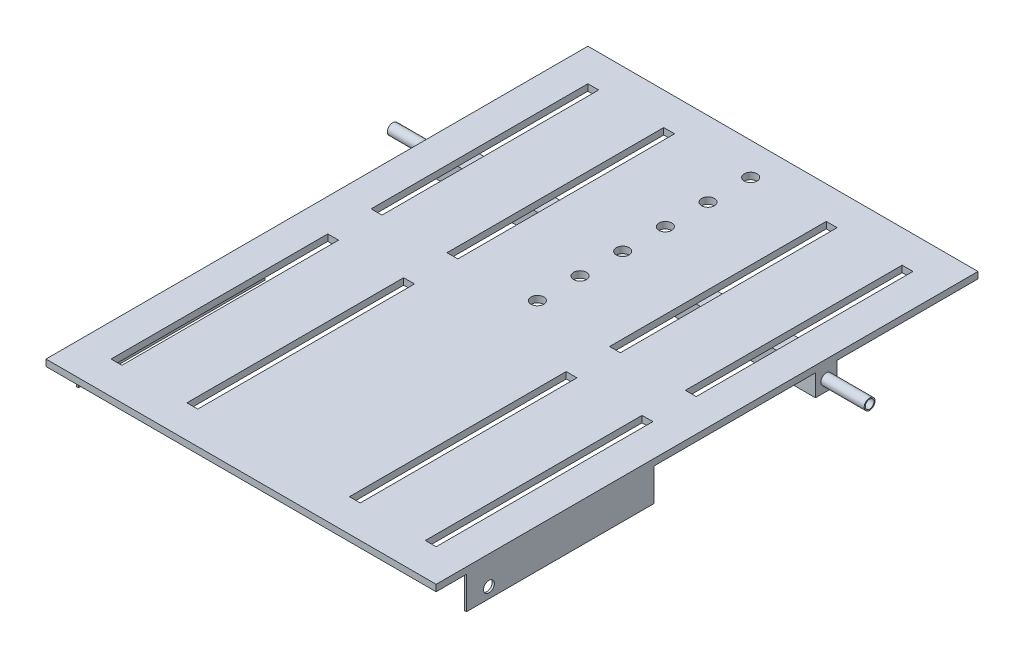
from build123d import *

# Parameters (mm, degrees)
SKETCH1_W               = 457.2
SKETCH1_H               = 635
BOSS_EXTRUDE1_DEPTH     = 7.62
SKETCH2_W               = 12.7
SKETCH2_H               = 254
CUT_EXTRUDE1_DEPTH      = 392.308413403
SKETCH5_W               = 25.4
SKETCH5_H               = 25.4
BOSS_EXTRUDE3_DEPTH     = 228.6
SKETCH6_R               = 6.35
BOSS_EXTRUDE4_DEPTH     = 50.8
BOSS_EXTRUDE6_DEPTH     = 38.1
CUT_EXTRUDE2_DEPTH      = 426.395026299
CUT_EXTRUDE2_DEPTH_BACK = 38.1
SKETCH8_W               = 152.4
SKETCH8_H               = 38.1
BOSS_EXTRUDE7_DEPTH     = 2.54
SKETCH9_W               = 457.2
SKETCH9_H               = 38.1
CUT_EXTRUDE3_DEPTH      = 10.16
CUT_EXTRUDE4_DEPTH      = 601.268156743
CUT_EXTRUDE4_DEPTH_BACK = 601.268156743
SKETCH10_R              = 6.35
SKETCH11_R              = 5.08
CUT_EXTRUDE5_DEPTH      = 25.4
SKETCH12_W              = 67.801888186
SKETCH12_H              = 38.1
CUT_EXTRUDE7_DEPTH      = 599.120114693
SKETCH16_R              = 7.5
CUT_EXTRUDE9_DEPTH      = 425.643638831
LPATTERN1_COUNT         = 5
LPATTERN1_PITCH         = 50
LPATTERN2_COUNT         = 3
LPATTERN2_PITCH         = 50


with BuildPart() as part:
    # Sketch1 → Boss-Extrude1 (new body)
    with BuildSketch(Plane(origin=(0, 0, 0), x_dir=(1, 0, 0), z_dir=(0, 1, 0))):
        Rectangle(SKETCH1_W, SKETCH1_H)
    extrude(amount=BOSS_EXTRUDE1_DEPTH)

    # Sketch2 → Cut-Extrude1 (cut, through all)
    with BuildSketch(Plane(origin=(0, 7.62, 0), x_dir=(1, 0, 0), z_dir=(0, 1, 0))):
        with Locations((-95.25, 152.4)):
            Rectangle(SKETCH2_W, SKETCH2_H)
        with Locations((-95.25, -152.4)):
            Rectangle(SKETCH2_W, SKETCH2_H)
        with Locations((-184.15, 152.4)):
            Rectangle(SKETCH2_W, SKETCH2_H)
        with Locations((-184.15, -152.4)):
            Rectangle(SKETCH2_W, SKETCH2_H)
        with Locations((184.15, 152.4)):
            Rectangle(SKETCH2_W, SKETCH2_H)
        with Locations((95.25, 152.4)):
            Rectangle(SKETCH2_W, SKETCH2_H)
        with Locations((184.15, -152.4)):
            Rectangle(SKETCH2_W, SKETCH2_H)
        with Locations((95.25, -152.4)):
            Rectangle(SKETCH2_W, SKETCH2_H)
    extrude(amount=-CUT_EXTRUDE1_DEPTH, mode=Mode.SUBTRACT)

    # Sketch5 → Boss-Extrude3 (add)
    with BuildSketch(Plane(origin=(228.6, 0, 0), x_dir=(0, 0, -1), z_dir=(1, 0, 0))):
        with Locations((139.7, -12.7)):
            Rectangle(SKETCH5_W, SKETCH5_H)
    boss_extrude3 = extrude(amount=-BOSS_EXTRUDE3_DEPTH)

    # Sketch6 → Boss-Extrude4 (add)
    with BuildSketch(Plane(origin=(228.6, 0, 0), x_dir=(0, 0, -1), z_dir=(1, 0, 0))):
        with Locations(Location((139.7, -12.7, 0), (0, 0, 180))):
            Circle(SKETCH6_R)
    boss_extrude4 = extrude(amount=BOSS_EXTRUDE4_DEPTH)

    # Sketch3 → Boss-Extrude6 (add)
    with BuildSketch(Plane.XZ):
        Polygon((-228.6, 292.1), (228.6, 292.1), (228.6, -5.532066332), (-228.6, 215.9), align=None)
    extrude(amount=BOSS_EXTRUDE6_DEPTH)

    # Mirror2: Boss-Extrude3, Boss-Extrude4 across plane
    add(boss_extrude3.mirror(Plane(origin=(0, 0, 0), x_dir=(0, 0, 1), z_dir=(1, 0, 0))))
    add(boss_extrude4.mirror(Plane(origin=(0, 0, 0), x_dir=(0, 0, 1), z_dir=(1, 0, 0))))

    # Sketch7 → Cut-Extrude2 (cut, two sides: drawn at the far end of the back side and taken through both)
    with BuildSketch(Plane.XZ.offset(38.1).offset(-CUT_EXTRUDE2_DEPTH_BACK)):
        Polygon((-226.06, 214.669821854), (226.06, -4.301888186), (226.06, 289.56), (-226.06, 289.56), align=None)
    extrude(amount=CUT_EXTRUDE2_DEPTH + CUT_EXTRUDE2_DEPTH_BACK, mode=Mode.SUBTRACT)

    # Sketch8 → Boss-Extrude7 (add)
    with BuildSketch(Plane.ZY.offset(228.6)):
        with Locations((139.7, -19.05)):
            Rectangle(SKETCH8_W, SKETCH8_H)
    extrude(amount=-BOSS_EXTRUDE7_DEPTH)

    # Sketch9 → Cut-Extrude3 (cut)
    with BuildSketch(Plane.XY.offset(292.1)):
        with Locations((0, -19.05)):
            Rectangle(SKETCH9_W, SKETCH9_H)
    extrude(amount=-CUT_EXTRUDE3_DEPTH, mode=Mode.SUBTRACT)

    # Sketch10 → Cut-Extrude4 (cut, two sides: drawn at the far end of the back side and taken through both)
    with BuildSketch(Plane.ZY.offset(228.6).offset(-CUT_EXTRUDE4_DEPTH_BACK)):
        with Locations((255.61861162, -25.709236818)):
            Circle(SKETCH10_R)
    extrude(amount=CUT_EXTRUDE4_DEPTH + CUT_EXTRUDE4_DEPTH_BACK, mode=Mode.SUBTRACT)

    # Sketch11 → Cut-Extrude5 (cut)
    with BuildSketch(Plane(origin=(279.4, 0, 0), x_dir=(0, 0, -1), z_dir=(1, 0, 0))):
        with Locations((139.7, -12.7)):
            Circle(SKETCH11_R)
    cut_extrude5 = extrude(amount=-CUT_EXTRUDE5_DEPTH, mode=Mode.SUBTRACT)

    # Mirror3: Cut-Extrude5 across plane
    add(cut_extrude5.mirror(Plane(origin=(0, 0, 0), x_dir=(0, 0, 1), z_dir=(1, 0, 0))), mode=Mode.SUBTRACT)

    # Sketch12 → Cut-Extrude7 (cut, through all)
    with BuildSketch(Plane.ZY.offset(-226.06)):
        with Locations((28.368877761, -19.05)):
            Rectangle(SKETCH12_W, SKETCH12_H)
    extrude(amount=-CUT_EXTRUDE7_DEPTH, mode=Mode.SUBTRACT)

    # Sketch16 → Cut-Extrude9 (cut, through all)
    with BuildSketch(Plane.XZ):
        with Locations(Location((0, -229.727054267, 0), (0, 0, 270))):
            Circle(SKETCH16_R)
    cut_extrude9 = extrude(amount=-CUT_EXTRUDE9_DEPTH, mode=Mode.SUBTRACT)

    # LPattern1: Cut-Extrude9 ×5
    with Locations(*[(0, 0, i * LPATTERN1_PITCH) for i in range(1, LPATTERN1_COUNT)]):
        add(cut_extrude9, mode=Mode.SUBTRACT)

    # LPattern2: Cut-Extrude9 ×3
    with Locations(*[(0, 0, -i * LPATTERN2_PITCH) for i in range(1, LPATTERN2_COUNT)]):
        add(cut_extrude9, mode=Mode.SUBTRACT)


solid = part.part
